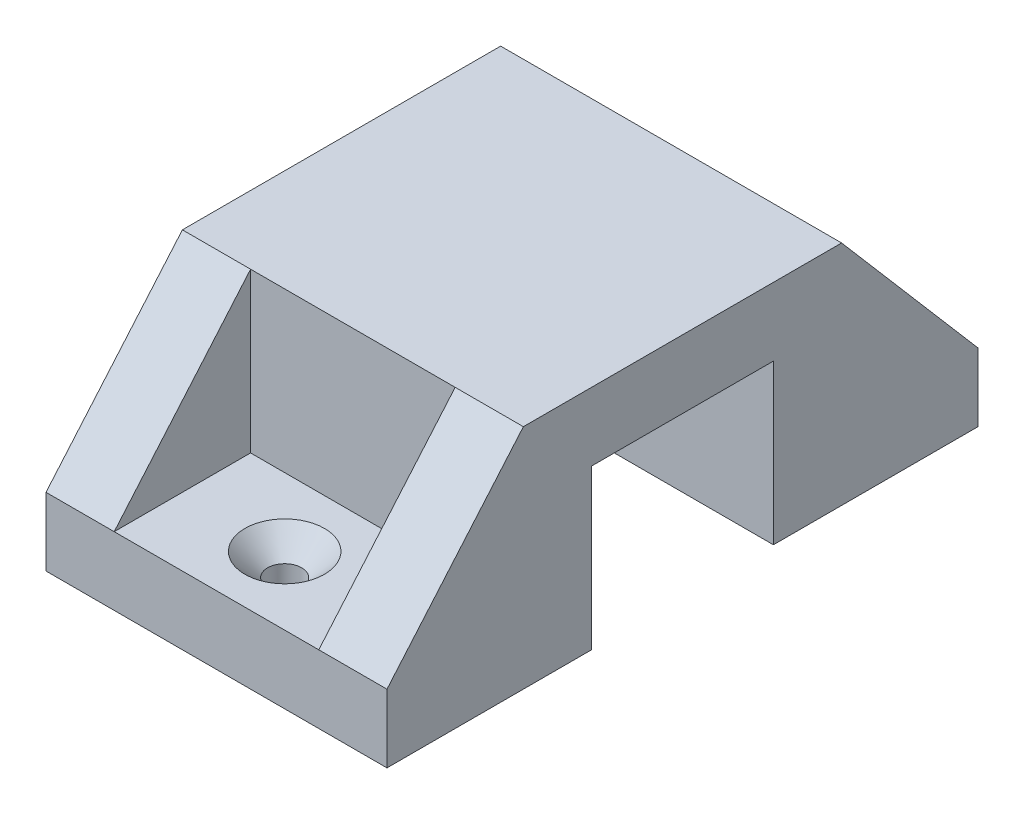
from build123d import *

# Parameters (mm, degrees)
SKETCH1_W               = 30
SKETCH1_H               = 28
BOSS_EXTRUDE1_DEPTH     = 20
SKETCH2_W               = 16
SKETCH2_H               = 14
CUT_EXTRUDE1_DEPTH      = 39.678159212
SKETCH3_W               = 30
SKETCH3_H               = 6
BOSS_EXTRUDE2_DEPTH     = 12
RIB11_REACH             = 46.452
SKETCH4_WALL_W          = 109.343531998
SKETCH4_WALL_H          = 6
MIRROR2_COPY_1_REACH    = 46.452
MIRROR2_COPY_1_SKETCH_W = 109.343531998
MIRROR2_COPY_1_SKETCH_H = 6
SKETCH6_R               = 1.5
CUT_EXTRUDE2_DEPTH      = 34.120990323
CHAMFER1_SIZE           = 2
CHAMFER2_SIZE           = 2


with BuildPart() as part:
    # Sketch1 → Boss-Extrude1 (new body)
    with BuildSketch(Plane(origin=(0, 0, 0), x_dir=(1, 0, 0), z_dir=(0, 1, 0))):
        Rectangle(SKETCH1_W, SKETCH1_H)
    extrude(amount=BOSS_EXTRUDE1_DEPTH)

    # Sketch2 → Cut-Extrude1 (cut, through all)
    with BuildSketch(Plane(origin=(15, 0, 0), x_dir=(0, 0, -1), z_dir=(1, 0, 0))):
        with Locations((0, 7)):
            Rectangle(SKETCH2_W, SKETCH2_H)
    extrude(amount=-CUT_EXTRUDE1_DEPTH, mode=Mode.SUBTRACT)

    # Sketch3 → Boss-Extrude2 (add)
    with BuildSketch(Plane.XY.offset(14)):
        with Locations((0, 3)):
            Rectangle(SKETCH3_W, SKETCH3_H)
    boss_extrude2 = extrude(amount=BOSS_EXTRUDE2_DEPTH)

    # Sketch4 wall → Rib11 (add, up to next)
    with BuildSketch(Plane(origin=(15, 13, 20), x_dir=(0, -0.759256602365, 0.650791373456), z_dir=(0, -0.650791373456, -0.759256602365)), mode=Mode.PRIVATE) as rib11_sk1:
        with Locations((0, 3)):
            Rectangle(SKETCH4_WALL_W, SKETCH4_WALL_H)
    rib11_tool1 = extrude(rib11_sk1.sketch, amount=RIB11_REACH, mode=Mode.PRIVATE) - part.part
    rib11 = rib11_tool1.solids().sort_by_distance((15, 13, 20))[0]
    add(rib11)

    # Mirror1: Rib11 across plane
    add(rib11.mirror(Plane(origin=(0, 0, 0), x_dir=(0, 0, 1), z_dir=(1, 0, 0))))

    # Mirror2: Boss-Extrude2, Rib11 across plane
    add(boss_extrude2.mirror(Plane.XY))
    add(rib11.mirror(Plane.XY))

    # Mirror2 copy 1 sketch → Mirror2 copy 1 (add, up to next)
    with BuildSketch(Plane(origin=(-15, 13, -20), x_dir=(0, -0.759256602365, -0.650791373456), z_dir=(0, -0.650791373456, 0.759256602365)), mode=Mode.PRIVATE) as mirror2_copy_1_sk1:
        with Locations((0, 3)):
            Rectangle(MIRROR2_COPY_1_SKETCH_W, MIRROR2_COPY_1_SKETCH_H)
    mirror2_copy_1_tool1 = extrude(mirror2_copy_1_sk1.sketch, amount=MIRROR2_COPY_1_REACH, mode=Mode.PRIVATE) - part.part
    add(mirror2_copy_1_tool1.solids().sort_by_distance((-15, 13, -20))[0])

    # Sketch6 → Cut-Extrude2 (cut, through all)
    with BuildSketch(Plane(origin=(0, 6, 0), x_dir=(1, 0, 0), z_dir=(0, 1, 0))):
        with Locations(Location((0, -20, 0), (0, 0, 270))):
            Circle(SKETCH6_R)
    cut_extrude2 = extrude(amount=-CUT_EXTRUDE2_DEPTH, mode=Mode.SUBTRACT)

    # Chamfer1
    chamfer1_edges = [part.edges().sort_by_distance(p)[0] for p in [
        (0, 6, 18.5),
    ]]
    chamfer(chamfer1_edges, length=CHAMFER1_SIZE)

    # Mirror7: Cut-Extrude2 across plane
    add(cut_extrude2.mirror(Plane.XY), mode=Mode.SUBTRACT)

    # Chamfer2
    chamfer2_edges = [part.edges().sort_by_distance(p)[0] for p in [
        (0, 6, -18.5),
    ]]
    chamfer(chamfer2_edges, length=CHAMFER2_SIZE)


solid = part.part
